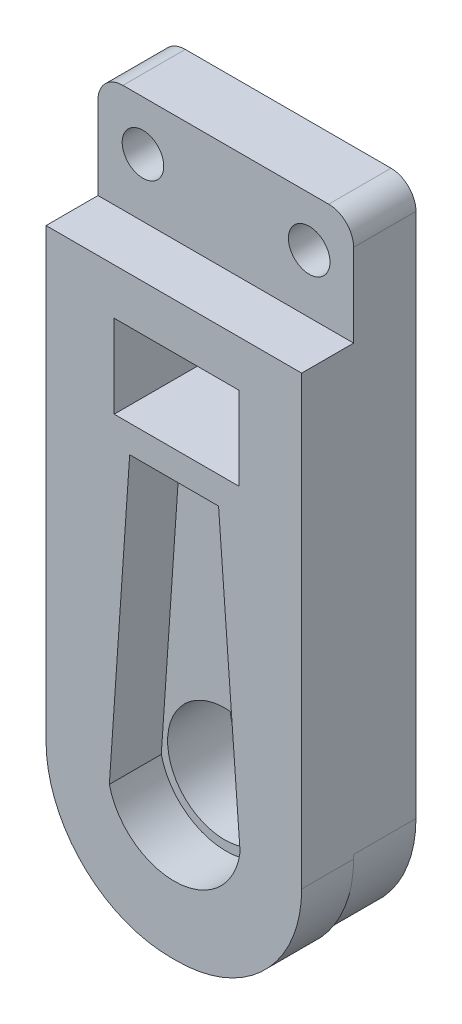
from build123d import *

# Parameters (mm, degrees)
SKETCH1_W           = 12.3
SKETCH1_H           = 32.5
SKETCH1_R           = 1
BOSS_EXTRUDE1_DEPTH = 3
FILLET1_R           = 1.2
FILLET2_R           = 6
SKETCH2_W           = 12.3
SKETCH2_H           = 27.5
BOSS_EXTRUDE2_DEPTH = 2.5
FILLET3_R           = 6
SKETCH3_W           = 6
SKETCH3_H           = 4
CUT_EXTRUDE1_DEPTH  = 227.640270134
CUT_EXTRUDE2_DEPTH  = 2.5
SKETCH5_R           = 2.75
CUT_EXTRUDE3_DEPTH  = 227.593384825


with BuildPart() as part:
    # Sketch1 → Boss-Extrude1 (new body)
    with BuildSketch(Plane.XY.offset(10)):
        with Locations((-182.01249108, 109.965842893)):
            Rectangle(SKETCH1_W, SKETCH1_H)
        with Locations((-185.999386631, 123.827694148)):
            Circle(SKETCH1_R, mode=Mode.SUBTRACT)
        with Locations((-177.999386631, 123.827694148)):
            Circle(SKETCH1_R, mode=Mode.SUBTRACT)
    extrude(amount=BOSS_EXTRUDE1_DEPTH)

    # Fillet1
    fillet1_edges = [part.edges().sort_by_distance(p)[0] for p in [
        (-188.16249108, 126.215842893, 11.5),
        (-175.86249108, 126.215842893, 11.5),
    ]]
    fillet(fillet1_edges, radius=FILLET1_R)

    # Fillet2
    fillet2_edges = [part.edges().sort_by_distance(p)[0] for p in [
        (-175.86249108, 93.715842893, 11.5),
        (-188.16249108, 93.715842893, 11.5),
    ]]
    fillet(fillet2_edges, radius=FILLET2_R)

    # Sketch2 → Boss-Extrude2 (add)
    with BuildSketch(Plane.XY.offset(13)):
        with Locations((-182.01249108, 107.27562942)):
            Rectangle(SKETCH2_W, SKETCH2_H)
    extrude(amount=BOSS_EXTRUDE2_DEPTH)

    # Fillet3
    fillet3_edges = [part.edges().sort_by_distance(p)[0] for p in [
        (-188.16249108, 93.52562942, 14.25),
        (-175.86249108, 93.52562942, 14.25),
    ]]
    fillet(fillet3_edges, radius=FILLET3_R)

    # Sketch3 → Cut-Extrude1 (cut, through all)
    with BuildSketch(Plane.XY.offset(15.5)):
        with Locations((-181.88348906, 116.80293228)):
            Rectangle(SKETCH3_W, SKETCH3_H)
    extrude(amount=-CUT_EXTRUDE1_DEPTH, mode=Mode.SUBTRACT)

    # Sketch4 → Cut-Extrude2 (cut)
    with BuildSketch(Plane.XY.offset(15.5)):
        with BuildLine():
            Line((-184.138427734, 113.48600769), (-179.861572266, 113.48600769))
            Line((-179.861572266, 113.48600769), (-178.824890137, 99.586959839))
            ThreePointArc((-178.824890137, 99.586959839), (-181.83374979, 96.789675787), (-185.116622925, 99.259651184))
            Line((-185.116622925, 99.259651184), (-184.138427734, 113.48600769))
        make_face()
    extrude(amount=-CUT_EXTRUDE2_DEPTH, mode=Mode.SUBTRACT)

    # Sketch5 → Cut-Extrude3 (cut, through all)
    with BuildSketch(Plane.XY.offset(13)):
        with Locations((-182.06249108, 99.972659898)):
            Circle(SKETCH5_R)
    extrude(amount=-CUT_EXTRUDE3_DEPTH, mode=Mode.SUBTRACT)


solid = part.part
